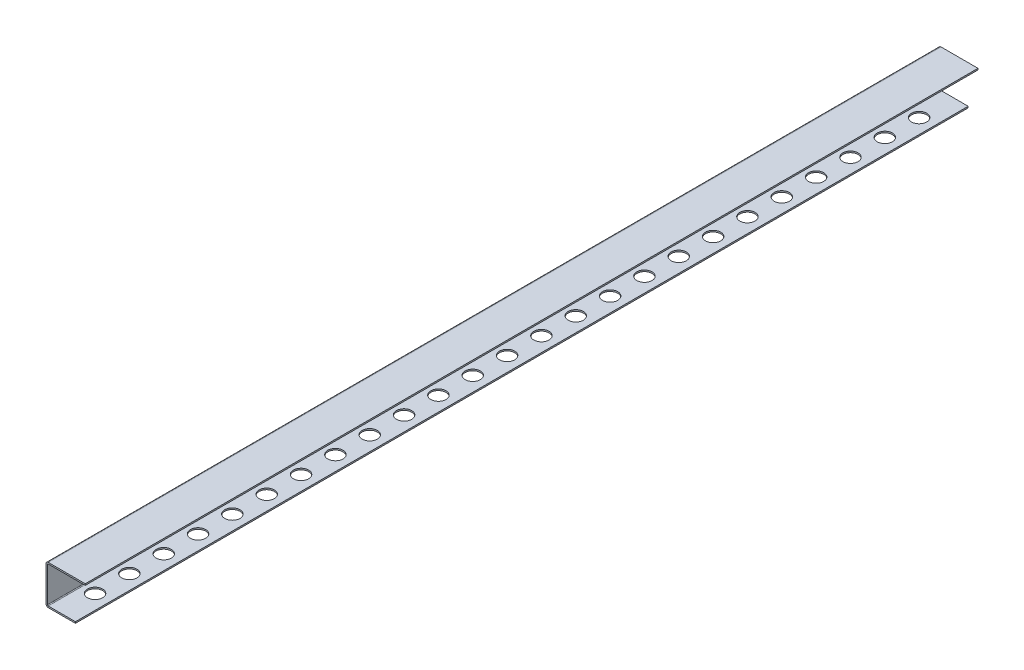
from build123d import *

# Parameters (mm, degrees)
BOSS_EXTRUDE1_DEPTH      = 10
BOSS_EXTRUDE1_DEPTH_BACK = 900
SKETCH2_R                = 7.75
CUT_EXTRUDE2_DEPTH       = 1.5
FILLET1_R                = 2.3
FILLET2_R                = 0.8


with BuildPart() as part:
    # Sketch1 → Boss-Extrude1 (new, two sides: drawn at the far end of the back side and taken through both)
    with BuildSketch(Plane.XY.offset(-BOSS_EXTRUDE1_DEPTH_BACK)):
        Polygon((0, 0), (30, 0), (30, 1.5), (1.5, 1.5), (1.5, 38.5), (40, 38.5), (40, 40), (0, 40), align=None)
    extrude(amount=BOSS_EXTRUDE1_DEPTH + BOSS_EXTRUDE1_DEPTH_BACK)

    # Sketch2 → Cut-Extrude2 (cut)
    with BuildSketch(Plane.XZ):
        with Locations(Location((15, -25, 0), (0, 0, 270))):
            Circle(SKETCH2_R)
        with Locations(Location((15, -60, 0), (0, 0, 270))):
            Circle(SKETCH2_R)
        with Locations(Location((15, -95, 0), (0, 0, 270))):
            Circle(SKETCH2_R)
        with Locations(Location((15, -130, 0), (0, 0, 270))):
            Circle(SKETCH2_R)
        with Locations(Location((15, -165, 0), (0, 0, 270))):
            Circle(SKETCH2_R)
        with Locations(Location((15, -200, 0), (0, 0, 270))):
            Circle(SKETCH2_R)
        with Locations(Location((15, -235, 0), (0, 0, 270))):
            Circle(SKETCH2_R)
        with Locations(Location((15, -270, 0), (0, 0, 270))):
            Circle(SKETCH2_R)
        with Locations(Location((15, -305, 0), (0, 0, 270))):
            Circle(SKETCH2_R)
        with Locations(Location((15, -340, 0), (0, 0, 270))):
            Circle(SKETCH2_R)
        with Locations(Location((15, -375, 0), (0, 0, 270))):
            Circle(SKETCH2_R)
        with Locations(Location((15, -410, 0), (0, 0, 270))):
            Circle(SKETCH2_R)
        with Locations(Location((15, -445, 0), (0, 0, 270))):
            Circle(SKETCH2_R)
        with Locations(Location((15, -480, 0), (0, 0, 270))):
            Circle(SKETCH2_R)
        with Locations(Location((15, -515, 0), (0, 0, 270))):
            Circle(SKETCH2_R)
        with Locations(Location((15, -550, 0), (0, 0, 270))):
            Circle(SKETCH2_R)
        with Locations(Location((15, -585, 0), (0, 0, 270))):
            Circle(SKETCH2_R)
        with Locations(Location((15, -620, 0), (0, 0, 270))):
            Circle(SKETCH2_R)
        with Locations(Location((15, -655, 0), (0, 0, 270))):
            Circle(SKETCH2_R)
        with Locations(Location((15, -690, 0), (0, 0, 270))):
            Circle(SKETCH2_R)
        with Locations(Location((15, -725, 0), (0, 0, 270))):
            Circle(SKETCH2_R)
        with Locations(Location((15, -760, 0), (0, 0, 270))):
            Circle(SKETCH2_R)
        with Locations(Location((15, -795, 0), (0, 0, 270))):
            Circle(SKETCH2_R)
        with Locations(Location((15, -830, 0), (0, 0, 270))):
            Circle(SKETCH2_R)
        with Locations(Location((15, -865, 0), (0, 0, 270))):
            Circle(SKETCH2_R)
    extrude(amount=-CUT_EXTRUDE2_DEPTH, mode=Mode.SUBTRACT)

    # Fillet1
    fillet1_edges = [part.edges().sort_by_distance(p)[0] for p in [
        (0, 40, -445),
        (0, 0, -445),
    ]]
    fillet(fillet1_edges, radius=FILLET1_R)

    # Fillet2
    fillet2_edges = [part.edges().sort_by_distance(p)[0] for p in [
        (1.5, 38.5, -445),
        (1.5, 1.5, -445),
    ]]
    fillet(fillet2_edges, radius=FILLET2_R)


solid = part.part
